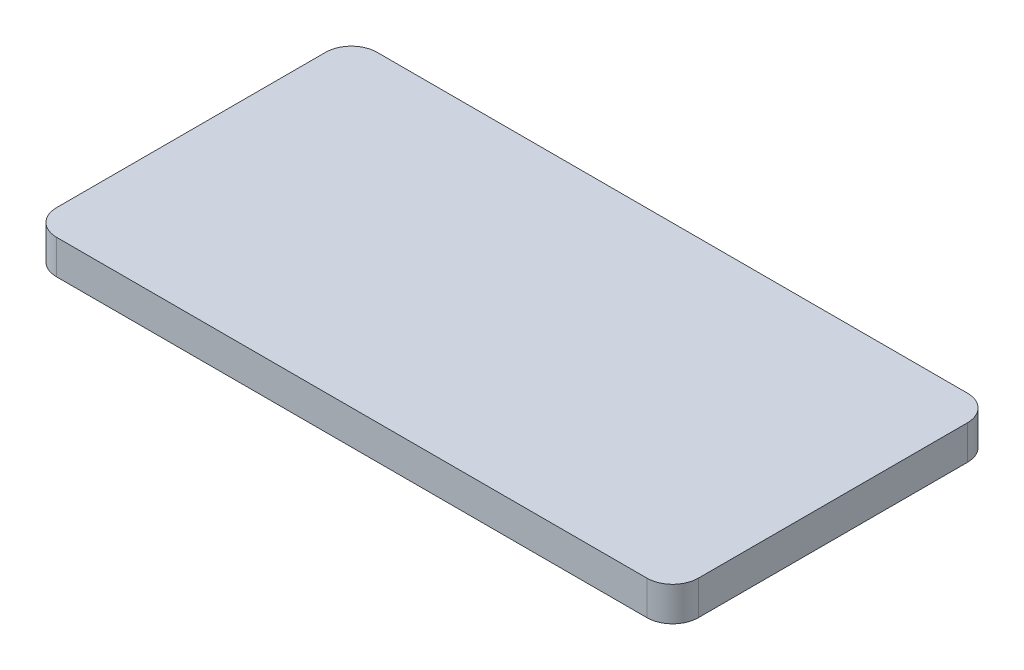
from build123d import *

# Parameters (mm, degrees)
EXTRUDE_1_DEPTH     = 8
SKETCH_2_6_R        = 1.25
EXTRUDE_6_DEPTH     = 2.5
SKETCH_2_7_R        = 1.65
CUT_EXTRUDE_1_DEPTH = 4
SKETCH_2_R          = 3.6
SKETCH_2_W          = 3.5
SKETCH_2_H          = 5.5
EXTRUDE_7_DEPTH     = 6.5


with BuildPart() as part:
    # 草图1 → 凸台-拉伸1 (new body)
    with BuildSketch(Plane(origin=(0, 0, 0), x_dir=(1, 0, 0), z_dir=(0, 1, 0))):
        with BuildLine():
            Line((6, 0), (143.8, 0))
            ThreePointArc((143.8, 0), (148.042640687, -1.757359313), (149.8, -6))
            Line((149.8, -6), (149.8, -68.8))
            ThreePointArc((149.8, -68.8), (148.042640687, -73.042640687), (143.8, -74.8))
            Line((143.8, -74.8), (6, -74.8))
            ThreePointArc((6, -74.8), (1.757359313, -73.042640687), (0, -68.8))
            Line((0, -68.8), (0, -6))
            ThreePointArc((0, -6), (1.757359313, -1.757359313), (6, 0))
        make_face()
    extrude(amount=EXTRUDE_1_DEPTH)

    # 草图2<6> → 凸台-拉伸6 (add)
    with BuildSketch(Plane(origin=(0, 0, 0), x_dir=(-1, 0, 0), z_dir=(0, -1, 0))):
        with Locations((-130.8, -5.6)):
            Circle(SKETCH_2_6_R)
        with Locations((-131.1, -55.65)):
            Circle(SKETCH_2_6_R)
        with Locations((-47.7, -4.85)):
            Circle(SKETCH_2_6_R)
        with Locations((-48.1, -68.75)):
            Circle(SKETCH_2_6_R)
        with Locations((-22.8, -70.3)):
            Circle(SKETCH_2_6_R)
        with Locations((-5.05, -71.05)):
            Circle(SKETCH_2_6_R)
        with Locations((-5.05, -3.25)):
            Circle(SKETCH_2_6_R)
    extrude(amount=EXTRUDE_6_DEPTH)

    # 草图2<7> → 切除-拉伸1 (cut)
    with BuildSketch(Plane(origin=(0, 0, 0), x_dir=(-1, 0, 0), z_dir=(0, -1, 0))):
        with Locations((-103.2, -9.35)):
            Circle(SKETCH_2_7_R)
        with Locations((-103.2, -64.25)):
            Circle(SKETCH_2_7_R)
        with Locations((-63.2, -64.25)):
            Circle(SKETCH_2_7_R)
        with Locations((-63.2, -9.35)):
            Circle(SKETCH_2_7_R)
    extrude(amount=-CUT_EXTRUDE_1_DEPTH, mode=Mode.SUBTRACT)

    # 草图2 → 凸台-拉伸7 (add)
    with BuildSketch(Plane(origin=(0, 0, 0), x_dir=(-1, 0, 0), z_dir=(0, -1, 0))):
        with Locations((-19, -37.4)):
            Circle(SKETCH_2_R)
        with Locations((-29.05, -37.4)):
            Rectangle(SKETCH_2_W, SKETCH_2_H)
    extrude(amount=EXTRUDE_7_DEPTH)


solid = part.part
